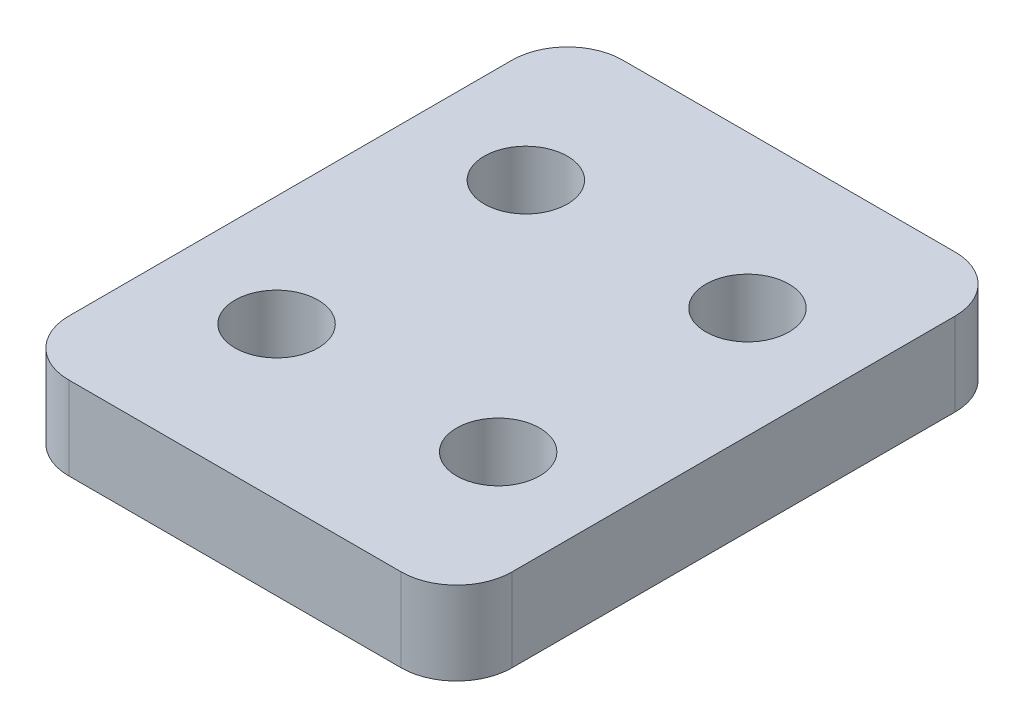
from build123d import *

# Parameters (mm, degrees)
SKETCH1_W           = 16
SKETCH1_H           = 20
BOSS_EXTRUDE1_DEPTH = 1.5
SKETCH2_R           = 1.5
CUT_EXTRUDE1_DEPTH  = 3
FILLET1_R           = 2


with BuildPart() as part:
    # Sketch1 → Boss-Extrude1 (new, symmetric)
    with BuildSketch(Plane(origin=(0, 0, 0), x_dir=(1, 0, 0), z_dir=(0, 1, 0))):
        Rectangle(SKETCH1_W, SKETCH1_H)
    extrude(amount=BOSS_EXTRUDE1_DEPTH, both=True)

    # Sketch2 → Cut-Extrude1 (cut)
    with BuildSketch(Plane(origin=(0, 1.5, 0), x_dir=(1, 0, 0), z_dir=(0, 1, 0))):
        with Locations(Location((-4, -4.5, 0), (0, 0, 270))):
            Circle(SKETCH2_R)
        with Locations(Location((-4, 4.5, 0), (0, 0, 270))):
            Circle(SKETCH2_R)
        with Locations(Location((4, 4.5, 0), (0, 0, 270))):
            Circle(SKETCH2_R)
        with Locations(Location((4, -4.5, 0), (0, 0, 270))):
            Circle(SKETCH2_R)
    extrude(amount=-CUT_EXTRUDE1_DEPTH, mode=Mode.SUBTRACT)

    # Fillet1
    fillet1_edges = [part.edges().sort_by_distance(p)[0] for p in [
        (8, 0, 10),
        (-8, 0, 10),
        (-8, 0, -10),
        (8, 0, -10),
    ]]
    fillet(fillet1_edges, radius=FILLET1_R)


solid = part.part
